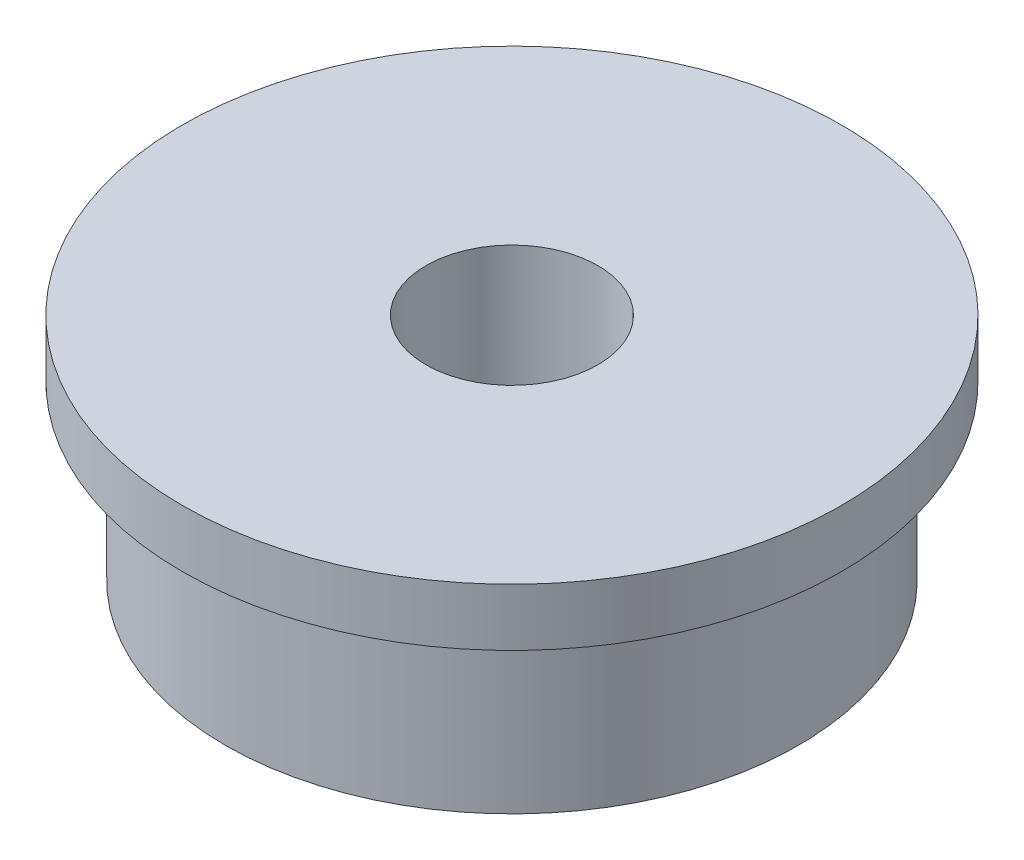
from build123d import *

# Parameters (mm, degrees)
SKETCH1_R           = 5
SKETCH1_R_2         = 1.5
BOSS_EXTRUDE1_DEPTH = 4
BOSS_EXTRUDE2_START = -1
SKETCH2_R           = 5.75
SKETCH2_R_2         = 5
BOSS_EXTRUDE2_DEPTH = 1


with BuildPart() as part:
    # Sketch1 → Boss-Extrude1 (new body)
    with BuildSketch(Plane(origin=(0, 0, 0), x_dir=(1, 0, 0), z_dir=(0, 1, 0))):
        with Locations(Location((0, 0, 0), (0, 0, 270))):
            Circle(SKETCH1_R)
        with Locations(Location((0, 0, 0), (0, 0, 270))):
            Circle(SKETCH1_R_2, mode=Mode.SUBTRACT)
    extrude(amount=BOSS_EXTRUDE1_DEPTH)

    # Sketch2 → Boss-Extrude2 (add)
    with BuildSketch(Plane(origin=(0, 4, 0), x_dir=(1, 0, 0), z_dir=(0, 1, 0)).offset(BOSS_EXTRUDE2_START)):
        with Locations(Location((0, 0, 0), (0, 0, 270))):
            Circle(SKETCH2_R)
        with Locations(Location((0, 0, 0), (0, 0, 270))):
            Circle(SKETCH2_R_2, mode=Mode.SUBTRACT)
    extrude(amount=BOSS_EXTRUDE2_DEPTH)


solid = part.part
